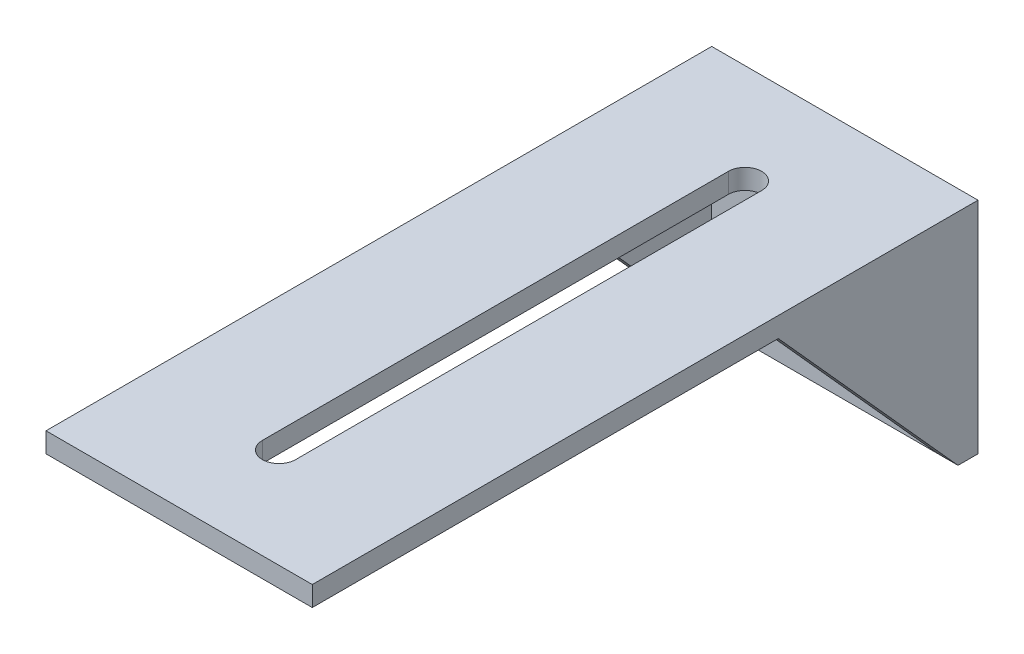
from build123d import *

# Parameters (mm, degrees)
SKETCH1_W               = 40
SKETCH1_H               = 100
BOSS_EXTRUDE1_DEPTH     = 3
SKETCH2_W               = 40
SKETCH2_H               = 3
BOSS_EXTRUDE2_DEPTH     = 30
CHAMFER1_SIZE           = 5
SKETCH3_W               = 3
SKETCH3_H               = 33
BOSS_EXTRUDE3_DEPTH     = 30
CUT_EXTRUDE1_DEPTH      = 50
CUT_EXTRUDE1_DEPTH_BACK = 30
SKETCH5_R               = 1.75
CUT_EXTRUDE2_DEPTH      = 30


with BuildPart() as part:
    # Sketch1 → Boss-Extrude1 (new body)
    with BuildSketch(Plane(origin=(0, 0, 0), x_dir=(1, 0, 0), z_dir=(0, 1, 0))):
        with Locations((20, -50)):
            Rectangle(SKETCH1_W, SKETCH1_H)
        with BuildLine():
            Line((17.5, -85), (17.5, -15))
            ThreePointArc((17.5, -15), (20, -12.5), (22.5, -15))
            Line((22.5, -15), (22.5, -85))
            ThreePointArc((22.5, -85), (20, -87.5), (17.5, -85))
        make_face(mode=Mode.SUBTRACT)
    extrude(amount=BOSS_EXTRUDE1_DEPTH)

    # Sketch2 → Boss-Extrude2 (add)
    with BuildSketch(Plane.XZ):
        with Locations((20, 1.5)):
            Rectangle(SKETCH2_W, SKETCH2_H)
    extrude(amount=BOSS_EXTRUDE2_DEPTH)

    # Chamfer1
    chamfer1_edges = [part.edges().sort_by_distance(p)[0] for p in [
        (20, 0, 3),
    ]]
    chamfer(chamfer1_edges, length=CHAMFER1_SIZE)

    # Sketch3 → Boss-Extrude3 (add)
    with BuildSketch(Plane(origin=(0, 0, 0), x_dir=(-1, 0, 0), z_dir=(0, 0, -1))):
        with Locations((-1.5, -13.5)):
            Rectangle(SKETCH3_W, SKETCH3_H)
        with Locations((-38.5, -13.5)):
            Rectangle(SKETCH3_W, SKETCH3_H)
    extrude(amount=-BOSS_EXTRUDE3_DEPTH)

    # Sketch4 → Cut-Extrude1 (cut, two sides: drawn at the far end of the back side and taken through both)
    with BuildSketch(Plane(origin=(3, 0, 0), x_dir=(0, 0, -1), z_dir=(1, 0, 0)).offset(-CUT_EXTRUDE1_DEPTH_BACK)):
        Polygon((-30, 0), (-3, -30), (-30, -30), align=None)
    extrude(amount=CUT_EXTRUDE1_DEPTH + CUT_EXTRUDE1_DEPTH_BACK, mode=Mode.SUBTRACT)

    # Sketch5 → Cut-Extrude2 (cut)
    with BuildSketch(Plane.XY.offset(3)):
        with Locations((20, -16.495296504)):
            Circle(SKETCH5_R)
    extrude(amount=-CUT_EXTRUDE2_DEPTH, mode=Mode.SUBTRACT)


solid = part.part
